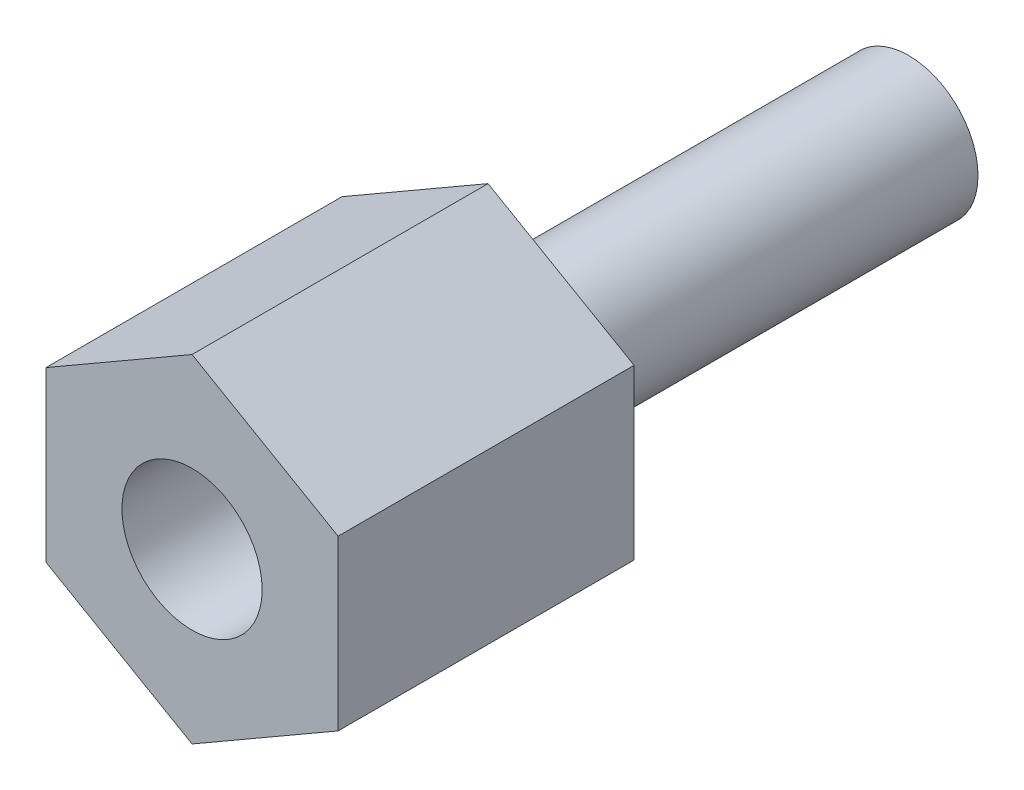
from build123d import *

# Parameters (mm, degrees)
BOSS_EXTRUDE1_DEPTH = 4.826
SKETCH2_R           = 1.1303
BOSS_EXTRUDE2_DEPTH = 6.858
SKETCH3_R           = 1.143
CUT_EXTRUDE1_DEPTH  = 2.54


with BuildPart() as part:
    # Sketch1 → Boss-Extrude1 (new body)
    with BuildSketch(Plane.XY):
        Polygon((0, 2.749630657), (-2.38125, 1.374815329), (-2.38125, -1.374815329), (0, -2.749630657), (2.38125, -1.374815329), (2.38125, 1.374815329), align=None)
    extrude(amount=BOSS_EXTRUDE1_DEPTH)

    # Sketch2 → Boss-Extrude2 (add)
    with BuildSketch(Plane(origin=(0, 0, 0), x_dir=(-1, 0, 0), z_dir=(0, 0, -1))):
        with Locations(Location((0, 0, 0), (0, 0, 180))):
            Circle(SKETCH2_R)
    extrude(amount=BOSS_EXTRUDE2_DEPTH)

    # Sketch3 → Cut-Extrude1 (cut)
    with BuildSketch(Plane.XY.offset(4.826)):
        Circle(SKETCH3_R)
    extrude(amount=-CUT_EXTRUDE1_DEPTH, mode=Mode.SUBTRACT)


solid = part.part
